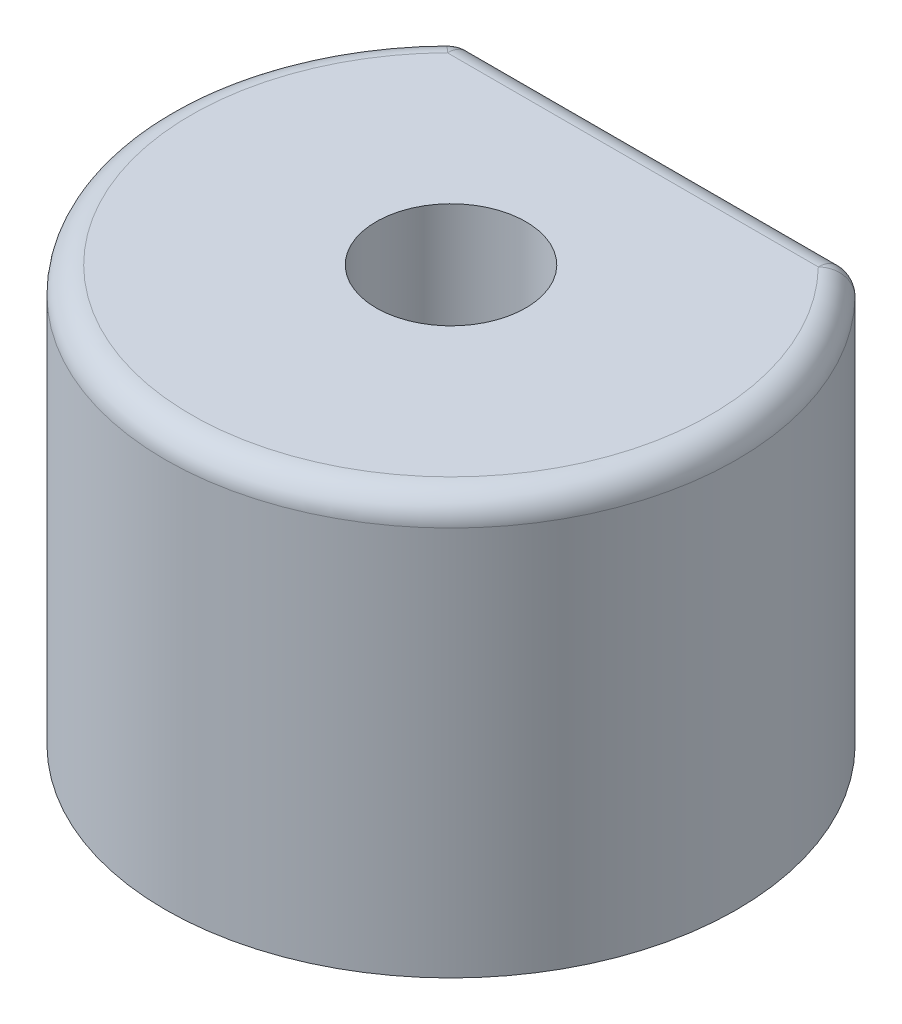
from build123d import *

# Parameters (mm, degrees)
SKETCH1_R           = 2.286
BOSS_EXTRUDE1_DEPTH = 12.7
FILLET1_R           = 0.79375


with BuildPart() as part:
    # Sketch1 → Boss-Extrude1 (new body)
    with BuildSketch(Plane(origin=(0, 0, 0), x_dir=(1, 0, 0), z_dir=(0, 1, 0))):
        with BuildLine():
            Line((5.992681083, 6.35), (-5.992681083, 6.35))
            ThreePointArc((-5.992681083, 6.35), (0, -8.73125), (5.992681083, 6.35))
        make_face()
        with Locations(Location((0, 0, 0), (0, 0, 270))):
            Circle(SKETCH1_R, mode=Mode.SUBTRACT)
    extrude(amount=BOSS_EXTRUDE1_DEPTH)

    # Fillet1
    fillet1_edges = [part.edges().sort_by_distance(p)[0] for p in [
        (-5.992681083, 6.35, -6.35),
        (5.992681083, 6.35, -6.35),
        (0, 12.7, 8.73125),
        (0, 12.7, -6.35),
    ]]
    fillet(fillet1_edges, radius=FILLET1_R)


solid = part.part
